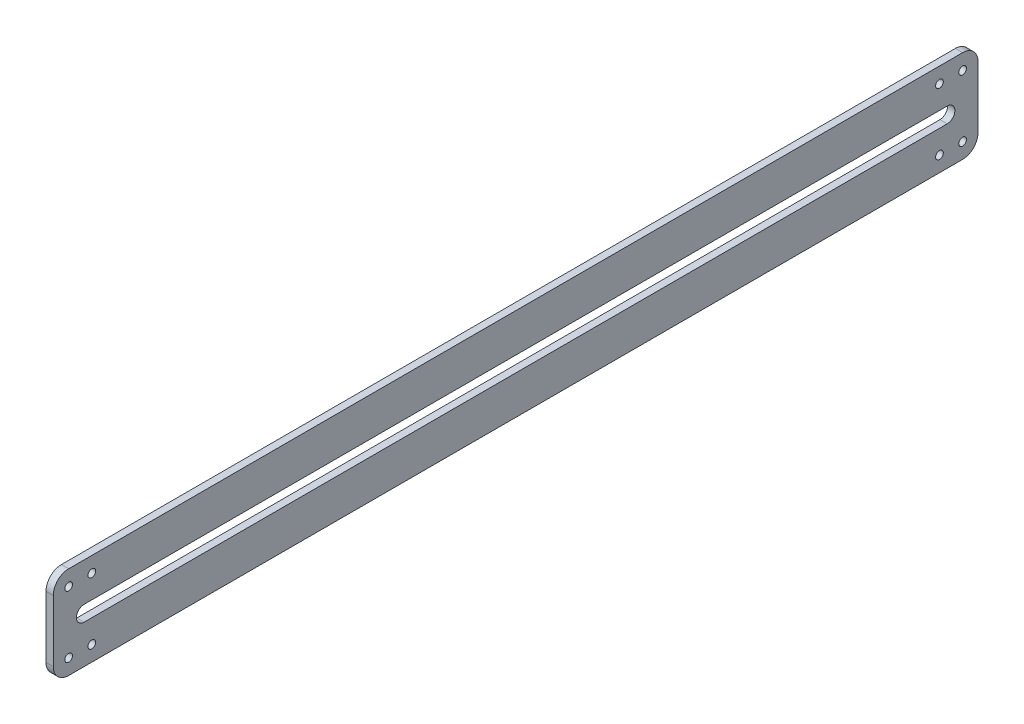
from build123d import *

# Parameters (mm, degrees)
OUTER_CUT_DEPTH   = 1.4986
SLOTS_DEPTH       = 192.473590105
SKETCH3_R         = 1.5875
MOUNT_HOLES_DEPTH = 192.473590105


with BuildPart() as part:
    # Sketch1 → Outer Cut (new, symmetric)
    with BuildSketch(Plane(origin=(0, 0, 0), x_dir=(0, 0, -1), z_dir=(1, 0, 0))):
        with BuildLine():
            Line((-184.15, -19.05), (184.15, -19.05))
            ThreePointArc((184.15, -19.05), (188.640128061, -17.190128061), (190.5, -12.7))
            Line((190.5, -12.7), (190.5, 12.7))
            ThreePointArc((190.5, 12.7), (188.640128061, 17.190128061), (184.15, 19.05))
            Line((184.15, 19.05), (-184.15, 19.05))
            ThreePointArc((-184.15, 19.05), (-188.640128061, 17.190128061), (-190.5, 12.7))
            Line((-190.5, 12.7), (-190.5, -12.7))
            ThreePointArc((-190.5, -12.7), (-188.640128061, -17.190128061), (-184.15, -19.05))
        make_face()
    extrude(amount=OUTER_CUT_DEPTH, both=True)

    # Sketch2 → Slots (cut, through all)
    with BuildSketch(Plane(origin=(1.4986, 0, 0), x_dir=(0, 0, -1), z_dir=(1, 0, 0))):
        with BuildLine():
            Line((-177.8, 3.175), (177.8, 3.175))
            ThreePointArc((177.8, 3.175), (180.975, 0), (177.8, -3.175))
            Line((177.8, -3.175), (-177.8, -3.175))
            ThreePointArc((-177.8, -3.175), (-180.975, 0), (-177.8, 3.175))
        make_face()
    extrude(amount=-SLOTS_DEPTH, mode=Mode.SUBTRACT)

    # Sketch3 → Mount Holes (cut, through all)
    with BuildSketch(Plane(origin=(1.4986, 0, 0), x_dir=(0, 0, -1), z_dir=(1, 0, 0))):
        with Locations((-184.15, 12.7)):
            Circle(SKETCH3_R)
        with Locations((-174.625, 12.7)):
            Circle(SKETCH3_R)
        with Locations((-174.625, -12.7)):
            Circle(SKETCH3_R)
        with Locations((-184.15, -12.7)):
            Circle(SKETCH3_R)
        with Locations((174.625, 12.7)):
            Circle(SKETCH3_R)
        with Locations((184.15, 12.7)):
            Circle(SKETCH3_R)
        with Locations((184.15, -12.7)):
            Circle(SKETCH3_R)
        with Locations((174.625, -12.7)):
            Circle(SKETCH3_R)
    extrude(amount=-MOUNT_HOLES_DEPTH, mode=Mode.SUBTRACT)


solid = part.part
